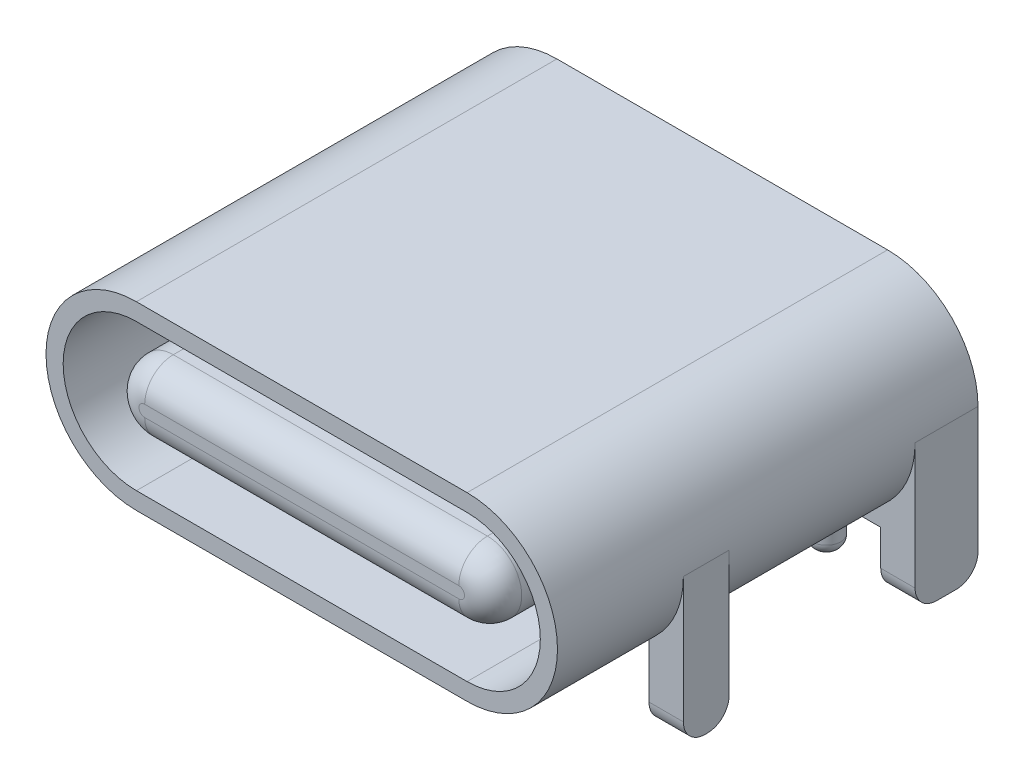
from build123d import *
from build123d.topology import SkipClean

# Parameters (mm, degrees)
SKETCH1_W           = 8.94
SKETCH1_H           = 7.35
BOSS_EXTRUDE1_DEPTH = 3.16
CUT_EXTRUDE1_DEPTH  = 2.2
CUT_EXTRUDE2_DEPTH  = 0.8
CUT_EXTRUDE3_START  = -4.35
CUT_EXTRUDE3_DEPTH  = 3.25
CUT_EXTRUDE4_START  = -3.25
CUT_EXTRUDE4_DEPTH  = 3.25
CUT_EXTRUDE5_DEPTH  = 6.25
FILLET1_R           = 0.5
CUT_EXTRUDE6_DEPTH  = 1.1
BOSS_EXTRUDE2_DEPTH = 0.6
BOSS_EXTRUDE3_START = -0.6
BOSS_EXTRUDE3_DEPTH = 0.6
BOSS_EXTRUDE4_START = -1
SKETCH11_R          = 0.25
BOSS_EXTRUDE4_DEPTH = 1.8
FILLET2_R           = 0.2
SKETCH12_W          = 0.45
SKETCH12_H          = 0.4
SKETCH12_W_2        = 0.2
BOSS_EXTRUDE5_DEPTH = 0.1
SKETCH13_W          = 0.45
SKETCH13_H          = 0.4
SKETCH13_W_2        = 0.2
BOSS_EXTRUDE6_DEPTH = 0.05


with BuildPart() as part:
    # Sketch1 → Boss-Extrude1 (new body)
    with BuildSketch(Plane(origin=(0, 0, 0), x_dir=(1, 0, 0), z_dir=(0, 1, 0))):
        Rectangle(SKETCH1_W, SKETCH1_H)
    extrude(amount=BOSS_EXTRUDE1_DEPTH)

    # Sketch2 → Cut-Extrude1 (cut)
    with BuildSketch(Plane.XY.offset(3.675)):
        with BuildLine():
            ThreePointArc((-4.47, 1.58), (-4.007228714, 2.697228714), (-2.89, 3.16))
            Line((-2.89, 3.16), (-4.47, 3.16))
            Line((-4.47, 3.16), (-4.47, 1.58))
        make_face()
        with BuildLine():
            Line((-4.47, 0), (-2.89, 0))
            ThreePointArc((-2.89, 0), (-4.007228714, 0.462771286), (-4.47, 1.58))
            Line((-4.47, 1.58), (-4.47, 0))
        make_face()
        with BuildLine():
            ThreePointArc((4.47, 1.58), (4.007228714, 0.462771286), (2.89, 0))
            Line((2.89, 0), (4.47, 0))
            Line((4.47, 0), (4.47, 1.58))
        make_face()
        with BuildLine():
            Line((4.47, 3.16), (2.89, 3.16))
            ThreePointArc((2.89, 3.16), (4.007228714, 2.697228714), (4.47, 1.58))
            Line((4.47, 1.58), (4.47, 3.16))
        make_face()
    extrude(amount=-CUT_EXTRUDE1_DEPTH, mode=Mode.SUBTRACT)

    # Sketch4 → Cut-Extrude2 (cut)
    with BuildSketch(Plane.XY.offset(1.475)):
        with BuildLine():
            Line((-2.89, 3.16), (-4.47, 3.16))
            Line((-4.47, 3.16), (-4.47, 1.58))
            ThreePointArc((-4.47, 1.58), (-4.007228714, 2.697228714), (-2.89, 3.16))
        make_face()
        with BuildLine():
            Line((4.47, 3.16), (2.89, 3.16))
            ThreePointArc((2.89, 3.16), (4.007228714, 2.697228714), (4.47, 1.58))
            Line((4.47, 1.58), (4.47, 3.16))
        make_face()
    extrude(amount=-CUT_EXTRUDE2_DEPTH, mode=Mode.SUBTRACT)

    # Sketch5 → Cut-Extrude3 (cut)
    with BuildSketch(Plane(origin=(0, 0, -3.675), x_dir=(-1, 0, 0), z_dir=(0, 0, -1)).offset(CUT_EXTRUDE3_START)):
        with BuildLine():
            Line((-2.89, 3.16), (-4.47, 3.16))
            Line((-4.47, 3.16), (-4.47, 1.58))
            ThreePointArc((-4.47, 1.58), (-4.007228714, 2.697228714), (-2.89, 3.16))
        make_face()
        with BuildLine():
            Line((4.47, 3.16), (2.89, 3.16))
            ThreePointArc((2.89, 3.16), (4.007228714, 2.697228714), (4.47, 1.58))
            Line((4.47, 1.58), (4.47, 3.16))
        make_face()
        with BuildLine():
            ThreePointArc((-2.89, 0), (-4.007228714, 0.462771286), (-4.47, 1.58))
            Line((-4.47, 1.58), (-4.47, 0))
            Line((-4.47, 0), (-2.89, 0))
        make_face()
        with BuildLine():
            Line((4.47, 0), (4.47, 1.58))
            ThreePointArc((4.47, 1.58), (4.007228714, 0.462771286), (2.89, 0))
            Line((2.89, 0), (4.47, 0))
        make_face()
    extrude(amount=CUT_EXTRUDE3_DEPTH, mode=Mode.SUBTRACT)

    # Sketch6 → Cut-Extrude4 (cut)
    with BuildSketch(Plane(origin=(0, 0, -3.675), x_dir=(-1, 0, 0), z_dir=(0, 0, -1)).offset(CUT_EXTRUDE4_START)):
        with BuildLine():
            Line((-2.89, 3.16), (-4.47, 3.16))
            Line((-4.47, 3.16), (-4.47, 1.58))
            ThreePointArc((-4.47, 1.58), (-4.007228714, 2.697228714), (-2.89, 3.16))
        make_face()
        with BuildLine():
            Line((4.47, 3.16), (2.89, 3.16))
            ThreePointArc((2.89, 3.16), (4.007228714, 2.697228714), (4.47, 1.58))
            Line((4.47, 1.58), (4.47, 3.16))
        make_face()
    extrude(amount=CUT_EXTRUDE4_DEPTH, mode=Mode.SUBTRACT)

    # Sketch7 → Cut-Extrude5 (cut)
    with BuildSketch(Plane.XY.offset(3.675)):
        with BuildLine():
            Line((-3.345, 1.58), (-3.345, 2.18))
            Line((-3.345, 2.18), (-2.745, 2.18))
            Line((-2.745, 2.18), (-1.759336478, 2.18))
            ThreePointArc((-1.759336478, 2.18), (-2.2303031, 2.676904736), (-2.89, 2.86))
            ThreePointArc((-2.89, 2.86), (-3.79509668, 2.48509668), (-4.17, 1.58))
            ThreePointArc((-4.17, 1.58), (-3.79509668, 0.67490332), (-2.89, 0.3))
            ThreePointArc((-2.89, 0.3), (-2.2303031, 0.483095264), (-1.759336478, 0.98))
            Line((-1.759336478, 0.98), (-2.745, 0.98))
            Line((-2.745, 0.98), (-3.345, 0.98))
            Line((-3.345, 0.98), (-3.345, 1.58))
        make_face()
        with BuildLine():
            Line((-2.745, 2.18), (-3.345, 2.18))
            Line((-3.345, 2.18), (-3.345, 1.58))
            ThreePointArc((-3.345, 1.58), (-3.169264069, 2.004264069), (-2.745, 2.18))
        make_face()
        with BuildLine():
            ThreePointArc((-2.745, 0.98), (-3.169264069, 1.155735931), (-3.345, 1.58))
            Line((-3.345, 1.58), (-3.345, 0.98))
            Line((-3.345, 0.98), (-2.745, 0.98))
        make_face()
        with BuildLine():
            Line((3.345, 0.98), (3.345, 1.58))
            ThreePointArc((3.345, 1.58), (3.169264069, 1.155735931), (2.745, 0.98))
            Line((2.745, 0.98), (3.345, 0.98))
        make_face()
        with BuildLine():
            ThreePointArc((-2.89, 2.86), (-2.2303031, 2.676904736), (-1.759336478, 2.18))
            Line((-1.759336478, 2.18), (1.759336478, 2.18))
            ThreePointArc((1.759336478, 2.18), (2.2303031, 2.676904736), (2.89, 2.86))
            Line((2.89, 2.86), (-2.89, 2.86))
        make_face()
        with BuildLine():
            Line((1.759336478, 0.98), (-1.759336478, 0.98))
            ThreePointArc((-1.759336478, 0.98), (-2.2303031, 0.483095264), (-2.89, 0.3))
            Line((-2.89, 0.3), (2.89, 0.3))
            ThreePointArc((2.89, 0.3), (2.2303031, 0.483095264), (1.759336478, 0.98))
        make_face()
        with BuildLine():
            Line((3.345, 2.18), (2.745, 2.18))
            ThreePointArc((2.745, 2.18), (3.169264069, 2.004264069), (3.345, 1.58))
            Line((3.345, 1.58), (3.345, 2.18))
        make_face()
        with BuildLine():
            ThreePointArc((2.89, 2.86), (2.2303031, 2.676904736), (1.759336478, 2.18))
            Line((1.759336478, 2.18), (2.745, 2.18))
            Line((2.745, 2.18), (3.345, 2.18))
            Line((3.345, 2.18), (3.345, 1.58))
            Line((3.345, 1.58), (3.345, 0.98))
            Line((3.345, 0.98), (2.745, 0.98))
            Line((2.745, 0.98), (1.759336478, 0.98))
            ThreePointArc((1.759336478, 0.98), (2.2303031, 0.483095264), (2.89, 0.3))
            ThreePointArc((2.89, 0.3), (3.79509668, 0.67490332), (4.17, 1.58))
            ThreePointArc((4.17, 1.58), (3.79509668, 2.48509668), (2.89, 2.86))
        make_face()
    extrude(amount=-CUT_EXTRUDE5_DEPTH, mode=Mode.SUBTRACT)

    # Fillet1
    fillet1_edges = [part.edges().sort_by_distance(p)[0] for p in [
        (-3.345, 1.58, 3.675),
        (0, 0.98, 3.675),
        (3.345, 1.58, 3.675),
        (0, 2.18, 3.675),
    ]]
    fillet(fillet1_edges, radius=FILLET1_R)

    # Sketch8 → Cut-Extrude6 (cut)
    with SkipClean():  # the faces are left unmerged after this step: merging them gives an invalid solid
        with BuildSketch(Plane.XY.offset(1.475)):
            with BuildLine():
                Line((-3.87, 0.340645329), (-3.87, 0))
                Line((-3.87, 0), (-2.89, 0))
                ThreePointArc((-2.89, 0), (-3.408757949, 0.087589135), (-3.87, 0.340645329))
            make_face()
            with BuildLine():
                ThreePointArc((3.87, 0.340645329), (3.408757949, 0.087589135), (2.89, 0))
                Line((2.89, 0), (3.87, 0))
                Line((3.87, 0), (3.87, 0.340645329))
            make_face()
        extrude(amount=-CUT_EXTRUDE6_DEPTH, mode=Mode.SUBTRACT)

    # Sketch9 → Boss-Extrude2 (add)
    with SkipClean():  # the faces are left unmerged after this step: merging them gives an invalid solid
        with BuildSketch(Plane.ZY.offset(4.47)):
            with BuildLine():
                Line((-3.675, 0), (-2.575, 0))
                Line((-2.575, 0), (-2.575, -0.62))
                ThreePointArc((-2.575, -0.62), (-2.686299423, -0.888700577), (-2.955, -1))
                Line((-2.955, -1), (-3.295, -1))
                ThreePointArc((-3.295, -1), (-3.563700577, -0.888700577), (-3.675, -0.62))
                Line((-3.675, -0.62), (-3.675, 0))
            make_face()
            with BuildLine():
                Line((0.675, 0), (1.475, 0))
                Line((1.475, 0), (1.475, -0.62))
                ThreePointArc((1.475, -0.62), (1.363700577, -0.888700577), (1.095, -1))
                Line((1.095, -1), (1.055, -1))
                ThreePointArc((1.055, -1), (0.786299423, -0.888700577), (0.675, -0.62))
                Line((0.675, -0.62), (0.675, 0))
            make_face()
        extrude(amount=-BOSS_EXTRUDE2_DEPTH)

    # Sketch10 → Boss-Extrude3 (add)
    with SkipClean():  # the faces are left unmerged after this step: merging them gives an invalid solid
        with BuildSketch(Plane(origin=(4.47, 0, 0), x_dir=(0, 0, -1), z_dir=(1, 0, 0)).offset(BOSS_EXTRUDE3_START)):
            with BuildLine():
                Line((-1.475, 0), (-0.675, 0))
                Line((-0.675, 0), (-0.675, -0.62))
                ThreePointArc((-0.675, -0.62), (-0.786299423, -0.888700577), (-1.055, -1))
                Line((-1.055, -1), (-1.095, -1))
                ThreePointArc((-1.095, -1), (-1.363700577, -0.888700577), (-1.475, -0.62))
                Line((-1.475, -0.62), (-1.475, 0))
            make_face()
            with BuildLine():
                Line((2.575, 0), (3.675, 0))
                Line((3.675, 0), (3.675, -0.62))
                ThreePointArc((3.675, -0.62), (3.563700577, -0.888700577), (3.295, -1))
                Line((3.295, -1), (2.955, -1))
                ThreePointArc((2.955, -1), (2.686299423, -0.888700577), (2.575, -0.62))
                Line((2.575, -0.62), (2.575, 0))
            make_face()
        extrude(amount=BOSS_EXTRUDE3_DEPTH)

    # Sketch11 → Boss-Extrude4 (add)
    with SkipClean():  # the faces are left unmerged after this step: merging them gives an invalid solid
        with BuildSketch(Plane.XZ.offset(BOSS_EXTRUDE4_START)):
            with Locations(Location((2.89, -2.605, 0), (0, 0, 90))):
                Circle(SKETCH11_R)
            with Locations(Location((-2.89, -2.605, 0), (0, 0, 90))):
                Circle(SKETCH11_R)
        extrude(amount=BOSS_EXTRUDE4_DEPTH)

    # Fillet2
    fillet2_edges = [part.edges().sort_by_distance(p)[0] for p in [
        (2.89, -0.8, -2.855),
        (-2.89, -0.8, -2.855),
    ]]
    fillet(fillet2_edges, radius=FILLET2_R)

    # Sketch12 → Boss-Extrude5 (add)
    with SkipClean():  # the faces are left unmerged after this step: merging them gives an invalid solid
        with BuildSketch(Plane.XZ):
            with Locations((-3.2, -3.875)):
                Rectangle(SKETCH12_W, SKETCH12_H)
            with Locations((0.25, -3.875)):
                Rectangle(SKETCH12_W_2, SKETCH12_H)
            with Locations((0.75, -3.875)):
                Rectangle(SKETCH12_W_2, SKETCH12_H)
            with Locations((1.25, -3.875)):
                Rectangle(SKETCH12_W_2, SKETCH12_H)
            with Locations((1.75, -3.875)):
                Rectangle(SKETCH12_W_2, SKETCH12_H)
            with Locations((2.4, -3.875)):
                Rectangle(SKETCH12_W, SKETCH12_H)
            with Locations((3.2, -3.875)):
                Rectangle(SKETCH12_W, SKETCH12_H)
            with Locations((-2.4, -3.875)):
                Rectangle(SKETCH12_W, SKETCH12_H)
            with Locations((-1.75, -3.875)):
                Rectangle(SKETCH12_W_2, SKETCH12_H)
            with Locations((-1.25, -3.875)):
                Rectangle(SKETCH12_W_2, SKETCH12_H)
            with Locations((-0.75, -3.875)):
                Rectangle(SKETCH12_W_2, SKETCH12_H)
            with Locations((-0.25, -3.875)):
                Rectangle(SKETCH12_W_2, SKETCH12_H)
        extrude(amount=-BOSS_EXTRUDE5_DEPTH)

    # Sketch13 → Boss-Extrude6 (add)
    with SkipClean():  # the faces are left unmerged after this step: merging them gives an invalid solid
        with BuildSketch(Plane.XZ):
            with Locations((-3.2, -3.875)):
                Rectangle(SKETCH13_W, SKETCH13_H)
            with Locations((-2.4, -3.875)):
                Rectangle(SKETCH13_W, SKETCH13_H)
            with Locations((-1.75, -3.875)):
                Rectangle(SKETCH13_W_2, SKETCH13_H)
            with Locations((-1.25, -3.875)):
                Rectangle(SKETCH13_W_2, SKETCH13_H)
            with Locations((-0.75, -3.875)):
                Rectangle(SKETCH13_W_2, SKETCH13_H)
            with Locations((-0.25, -3.875)):
                Rectangle(SKETCH13_W_2, SKETCH13_H)
            with Locations((0.25, -3.875)):
                Rectangle(SKETCH13_W_2, SKETCH13_H)
            with Locations((0.75, -3.875)):
                Rectangle(SKETCH13_W_2, SKETCH13_H)
            with Locations((1.25, -3.875)):
                Rectangle(SKETCH13_W_2, SKETCH13_H)
            with Locations((1.75, -3.875)):
                Rectangle(SKETCH13_W_2, SKETCH13_H)
            with Locations((2.4, -3.875)):
                Rectangle(SKETCH13_W, SKETCH13_H)
            with Locations((3.2, -3.875)):
                Rectangle(SKETCH13_W, SKETCH13_H)
        extrude(amount=BOSS_EXTRUDE6_DEPTH)


solid = part.part
